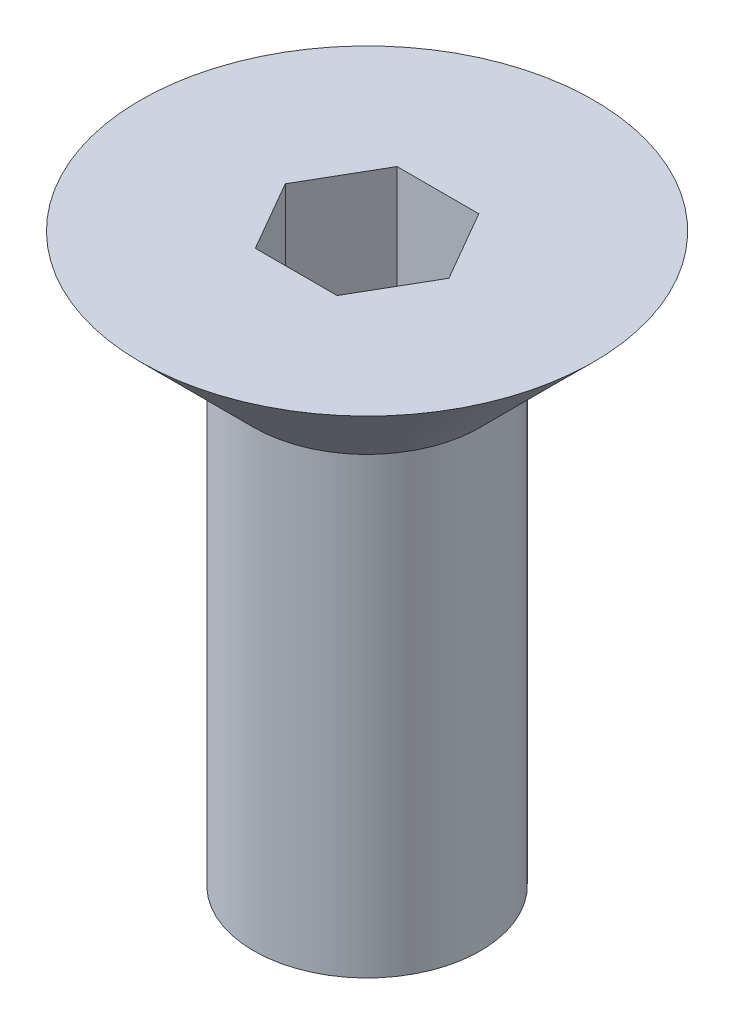
from build123d import *

# Parameters (mm, degrees)
CUT_EXTRUDE1_DEPTH = 5


with BuildPart() as part:
    # Sketch1 → Revolve1 (revolve)
    with BuildSketch(Plane.XY, mode=Mode.PRIVATE) as revolve1_sk:
        Polygon((0, -20), (4, -20), (4, -4), (8, 0), (0, 0), align=None)
    revolve(revolve1_sk.sketch.rotate(Axis((0, 61.691642626, 0), (0, -1, 0)), 90), axis=Axis((0, 61.691642626, 0), (0, -1, 0)))

    # Sketch2 → Cut-Extrude1 (cut)
    with BuildSketch(Plane(origin=(0, 0, 0), x_dir=(-1, 0, 0), z_dir=(0, 1, 0))):
        Polygon((-1.443375673, -2.5), (1.443375673, -2.5), (2.886751346, 0), (1.443375673, 2.5), (-1.443375673, 2.5), (-2.886751346, 0), align=None)
    extrude(amount=-CUT_EXTRUDE1_DEPTH, mode=Mode.SUBTRACT)


solid = part.part
